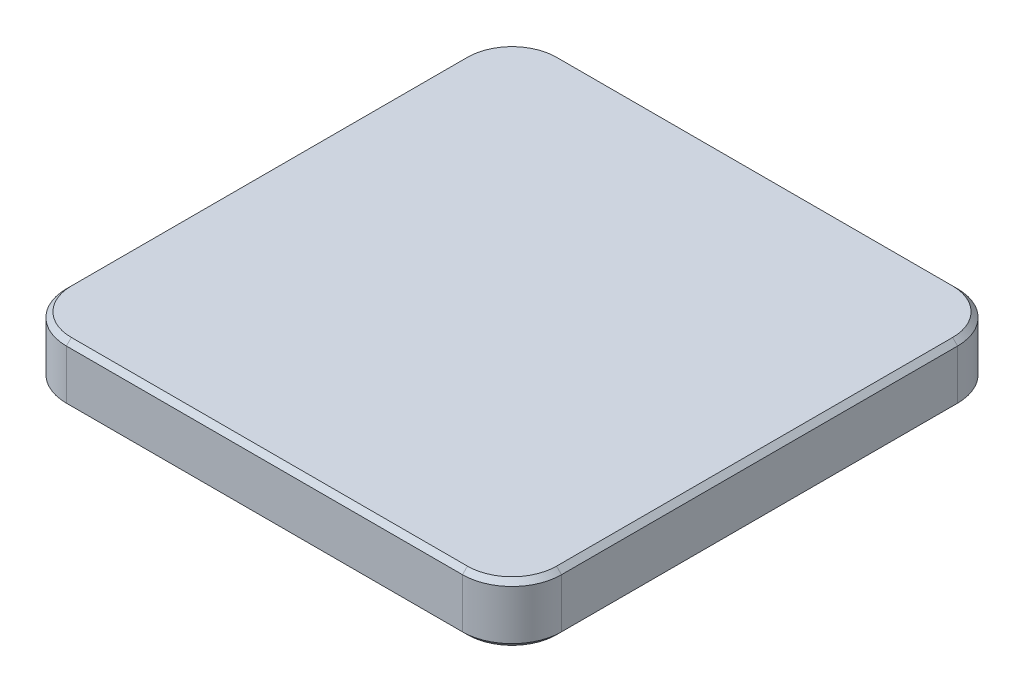
from build123d import *

# Parameters (mm, degrees)
BOSS_EXTRUDE1_DEPTH = 6
CHAMFER1_SIZE       = 1


with BuildPart() as part:
    # Sketch2 → Boss-Extrude1 (new, symmetric)
    with BuildSketch(Plane(origin=(0, 0, 0), x_dir=(1, 0, 0), z_dir=(0, 1, 0))):
        with BuildLine():
            Line((-40, -50), (40, -50))
            ThreePointArc((40, -50), (47.071067812, -47.071067812), (50, -40))
            Line((50, -40), (50, 40))
            ThreePointArc((50, 40), (47.071067812, 47.071067812), (40, 50))
            Line((40, 50), (-40, 50))
            ThreePointArc((-40, 50), (-47.071067812, 47.071067812), (-50, 40))
            Line((-50, 40), (-50, -40))
            ThreePointArc((-50, -40), (-47.071067812, -47.071067812), (-40, -50))
        make_face()
    extrude(amount=BOSS_EXTRUDE1_DEPTH, both=True)

    # Chamfer1
    chamfer1_edges = [part.edges().sort_by_distance(p)[0] for p in [
        (50, -6, 0),
        (47.071067812, -6, 47.071067812),
        (0, -6, 50),
        (-47.071067812, -6, 47.071067812),
        (47.071067812, 6, 47.071067812),
        (50, 6, 0),
        (47.071067812, 6, -47.071067812),
        (0, 6, -50),
        (-47.071067812, 6, -47.071067812),
        (-50, 6, 0),
        (-47.071067812, 6, 47.071067812),
        (-50, -6, 0),
        (0, 6, 50),
        (-47.071067812, -6, -47.071067812),
        (0, -6, -50),
        (47.071067812, -6, -47.071067812),
    ]]
    chamfer(chamfer1_edges, length=CHAMFER1_SIZE)


solid = part.part
